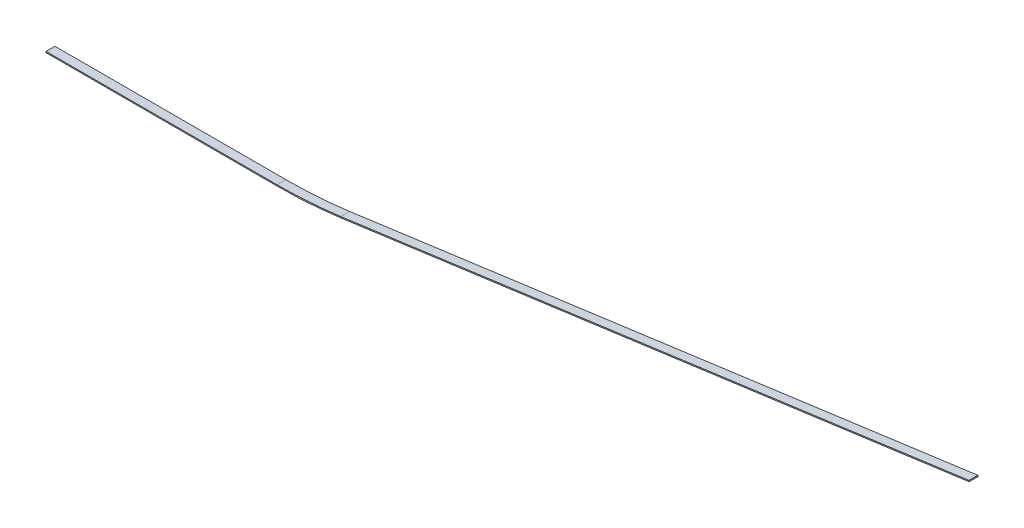
from build123d import *

# Parameters (mm, degrees)
BOSS_EXTRUDE1_DEPTH = 9.525


with BuildPart() as part:
    # Sketch2 → Boss-Extrude1 (new body)
    with BuildSketch(Plane.XY):
        with BuildLine():
            Line((5501.692216973, 3000.892166094), (5501.692216973, 3002.111366094))
            Line((5501.692216973, 3002.111366094), (5749.802847516, 3002.111366094))
            ThreePointArc((5749.802847516, 3002.111366094), (5784.105650255, 3003.27363699), (5818.251110217, 3006.755118484))
            Line((5818.251110217, 3006.755118484), (6493.146039363, 3098.752682945))
            Line((6493.146039363, 3098.752682945), (6493.315720667, 3097.545337731))
            Line((6493.315720667, 3097.545337731), (5818.415781258, 3005.547090302))
            ThreePointArc((5818.415781258, 3005.547090302), (5784.188175041, 3002.057233151), (5749.802847516, 3000.892166094))
            Line((5749.802847516, 3000.892166094), (5501.692216973, 3000.892166094))
        make_face()
    extrude(amount=BOSS_EXTRUDE1_DEPTH)


solid = part.part
